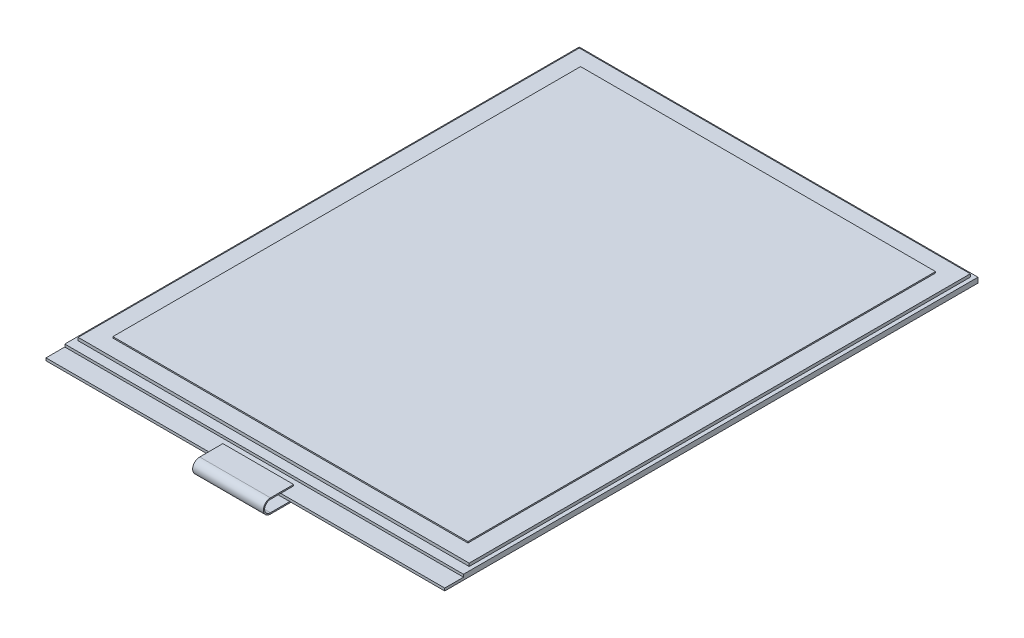
from build123d import *

# Parameters (mm, degrees)
SKETCH1_W           = 31
SKETCH1_H           = 41.46
BOSS_EXTRUDE1_DEPTH = 0.2
SKETCH2_W           = 31
SKETCH2_H           = 40
BOSS_EXTRUDE2_DEPTH = 0.2
SKETCH3_W           = 30.4
SKETCH3_H           = 38.96
BOSS_EXTRUDE3_DEPTH = 0.23
SKETCH4_W           = 30.4
SKETCH4_H           = 38.96
BOSS_EXTRUDE4_DEPTH = 0.115
BOSS_EXTRUDE5_DEPTH = 2.75
SKETCH7_W           = 27.6
SKETCH7_H           = 36.36
BOSS_EXTRUDE6_DEPTH = 0.1


with BuildPart() as part:
    # Sketch1 → Boss-Extrude1 (new body)
    with BuildSketch(Plane(origin=(0, 0, 0), x_dir=(1, 0, 0), z_dir=(0, 1, 0))):
        Rectangle(SKETCH1_W, SKETCH1_H)
    extrude(amount=BOSS_EXTRUDE1_DEPTH)

    # Sketch2 → Boss-Extrude2 (add)
    with BuildSketch(Plane(origin=(0, 0.2, 0), x_dir=(1, 0, 0), z_dir=(0, 1, 0))):
        with Locations((0, 0.73)):
            Rectangle(SKETCH2_W, SKETCH2_H)
    extrude(amount=BOSS_EXTRUDE2_DEPTH)

    # Sketch3 → Boss-Extrude3 (add)
    with BuildSketch(Plane(origin=(0, 0.4, 0), x_dir=(1, 0, 0), z_dir=(0, 1, 0))):
        with Locations((0, 0.95)):
            Rectangle(SKETCH3_W, SKETCH3_H)
    extrude(amount=BOSS_EXTRUDE3_DEPTH)

    # Sketch4 → Boss-Extrude4 (add)
    with BuildSketch(Plane.XZ):
        with Locations((0, -0.95)):
            Rectangle(SKETCH4_W, SKETCH4_H)
    extrude(amount=BOSS_EXTRUDE4_DEPTH)

    # Sketch5 → Boss-Extrude5 (add, symmetric)
    with BuildSketch(Plane(origin=(0, 0, 0), x_dir=(0, 0, -1), z_dir=(1, 0, 0))):
        with BuildLine():
            Line((-20.73, 0.2), (-21.53, 0.2))
            ThreePointArc((-21.53, 0.2), (-21.98, -0.25), (-21.53, -0.7))
            Line((-21.53, -0.7), (-10.13, -0.7))
            Line((-10.13, -0.7), (-10.13, -0.8))
            Line((-10.13, -0.8), (-21.53, -0.8))
            ThreePointArc((-21.53, -0.8), (-22.08, -0.25), (-21.53, 0.3))
            Line((-21.53, 0.3), (-19.73, 0.3))
            Line((-19.73, 0.3), (-19.73, 0.2))
            Line((-19.73, 0.2), (-20.73, 0.2))
        make_face()
    extrude(amount=BOSS_EXTRUDE5_DEPTH, both=True)

    # Sketch7 → Boss-Extrude6 (add)
    with BuildSketch(Plane(origin=(0, 0.63, 0), x_dir=(1, 0, 0), z_dir=(0, 1, 0))):
        with Locations((0, 0.95)):
            Rectangle(SKETCH7_W, SKETCH7_H)
    extrude(amount=BOSS_EXTRUDE6_DEPTH)


solid = part.part
